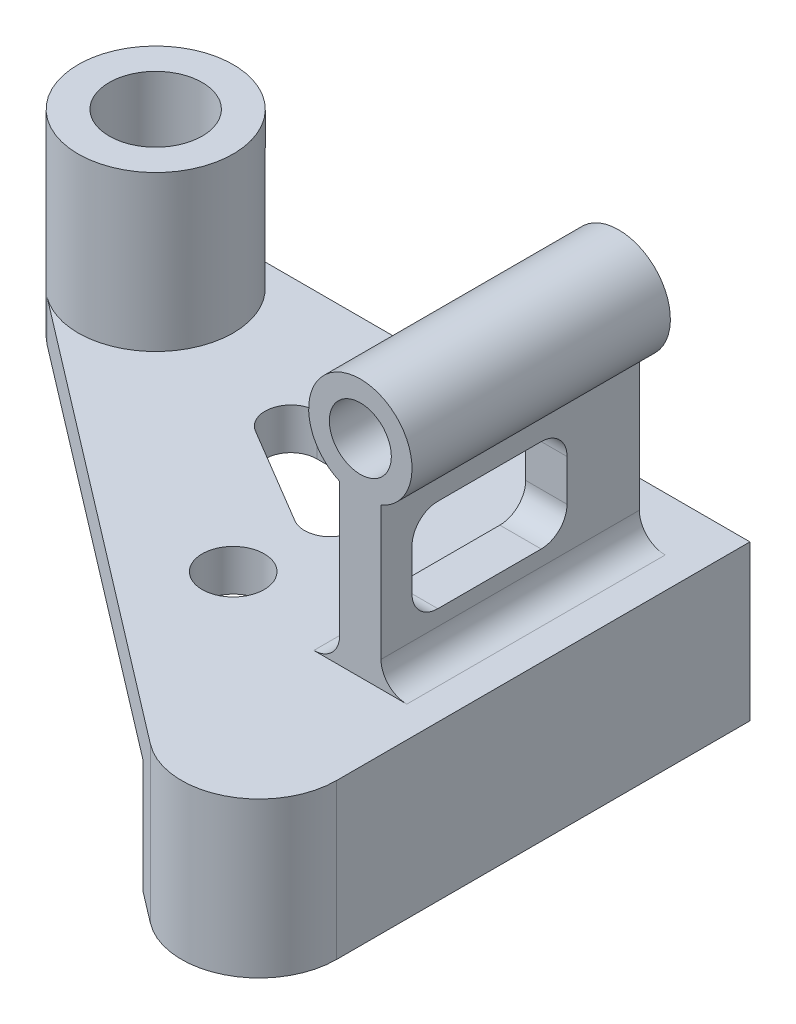
from build123d import *

# Parameters (mm, degrees)
SKETCH1_R           = 15
SKETCH1_R_2         = 9
SKETCH1_R_3         = 6
SKETCH1_W           = 10
SKETCH1_H           = 50
BOSS_EXTRUDE2_DEPTH = 30
SKETCH2_W           = 112.950636881
SKETCH2_H           = 38.744396061
CUT_EXTRUDE1_DEPTH  = 153.151240547
BOSS_EXTRUDE3_START = 30
SKETCH1_3_R         = 15
SKETCH1_3_R_2       = 9
BOSS_EXTRUDE3_DEPTH = 30
SKETCH1_4_W         = 20
SKETCH1_4_H         = 50
BOSS_EXTRUDE4_DEPTH = 50
SKETCH3_R           = 6
CUT_EXTRUDE2_DEPTH  = 140.185416071
FILLET1_R           = 5
CUT_EXTRUDE3_DEPTH  = 8


with BuildPart() as part:
    # Sketch1 → Boss-Extrude2 (new body)
    # profile 1 of 4: a face of its own
    with BuildSketch(Plane(origin=(0, 0, 0), x_dir=(1, 0, 0), z_dir=(0, 1, 0))):
        with Locations((-100, -15)):
            Circle(SKETCH1_R)
        with Locations(Location((-100, -15, 0), (0, 0, 270))):
            Circle(SKETCH1_R_2, mode=Mode.SUBTRACT)
    # profile 2 of 4: a face of its own
    with BuildSketch(Plane(origin=(0, 0, 0), x_dir=(1, 0, 0), z_dir=(0, 1, 0))):
        with BuildLine():
            Line((0, -80), (0, 0))
            Line((0, 0), (-100, 0))
            ThreePointArc((-100, 0), (-89.393398282, -4.393398282), (-85, -15))
            ThreePointArc((-85, -15), (-93.354560745, -28.447607114), (-109.111751614, -26.915367495))
            Line((-109.111751614, -26.915367495), (-24.111751614, -91.915367495))
            ThreePointArc((-24.111751614, -91.915367495), (-8.354560745, -93.447607114), (0, -80))
        make_face()
        with Locations(Location((-45, -55, 0), (0, 0, 270))):
            Circle(SKETCH1_R_3, mode=Mode.SUBTRACT)
        with BuildLine():
            ThreePointArc((-66.381939771, -29.296464422), (-68.64542921, -23.673787745), (-63.824520472, -20))
            Line((-63.824520472, -20), (-45, -20))
            ThreePointArc((-45, -20), (-41.464466094, -21.464466094), (-40, -25))
            Line((-40, -25), (-40, -36.20507171))
            ThreePointArc((-40, -36.20507171), (-42.528876419, -40.551742648), (-47.557419299, -40.501536132))
            Line((-47.557419299, -40.501536132), (-66.381939771, -29.296464422))
        make_face(mode=Mode.SUBTRACT)
        Polygon((-25, -60.395198873), (-25, -10.395198873), (-15, -10.395198873), (-5, -10.395198873), (-5, -60.395198873), (-15, -60.395198873), align=None, mode=Mode.SUBTRACT)
        with Locations(Location((-45, -10, 0), (0, 0, 270))):
            Circle(SKETCH1_R_3, mode=Mode.SUBTRACT)
    # profile 3 of 4: a face of its own
    with BuildSketch(Plane(origin=(0, 0, 0), x_dir=(1, 0, 0), z_dir=(0, 1, 0))):
        with Locations((-10, -35.395198873)):
            Rectangle(SKETCH1_W, SKETCH1_H)
    # profile 4 of 4: a face of its own
    with BuildSketch(Plane(origin=(0, 0, 0), x_dir=(1, 0, 0), z_dir=(0, 1, 0))):
        with Locations((-20, -35.395198873)):
            Rectangle(SKETCH1_W, SKETCH1_H)
    extrude(amount=-BOSS_EXTRUDE2_DEPTH)

    # Sketch2 → Cut-Extrude1 (cut, through all)
    with BuildSketch(Plane(origin=(0, 0, 0), x_dir=(-1, 0, 0), z_dir=(0, 0, -1))):
        with Locations((86.475318441, -27.372198031)):
            Rectangle(SKETCH2_W, SKETCH2_H)
    extrude(amount=-CUT_EXTRUDE1_DEPTH, mode=Mode.SUBTRACT)

    # Sketch1<3> → Boss-Extrude3 (add)
    with BuildSketch(Plane(origin=(0, 0, 0), x_dir=(1, 0, 0), z_dir=(0, 1, 0)).offset(BOSS_EXTRUDE3_START)):
        with Locations(Location((-100, -15, 0), (0, 0, 270))):
            Circle(SKETCH1_3_R)
        with Locations(Location((-100, -15, 0), (0, 0, 270))):
            Circle(SKETCH1_3_R_2, mode=Mode.SUBTRACT)
    extrude(amount=-BOSS_EXTRUDE3_DEPTH)

    # Sketch1<4> → Boss-Extrude4 (add)
    with BuildSketch(Plane(origin=(0, 0, 0), x_dir=(1, 0, 0), z_dir=(0, 1, 0))):
        with Locations((-15, -35.395198873)):
            Rectangle(SKETCH1_4_W, SKETCH1_4_H)
    extrude(amount=BOSS_EXTRUDE4_DEPTH)

    # Sketch3 → Cut-Extrude2 (cut, through all)
    with BuildSketch(Plane.XY.offset(60.395198873)):
        with BuildLine():
            ThreePointArc((-19, 30.83484861), (-23.366600265, 34.522774425), (-25, 40))
            Line((-25, 40), (-25, 0))
            Line((-25, 0), (-19, 0))
            Line((-19, 0), (-19, 30.83484861))
        make_face()
        with BuildLine():
            Line((-5, 0), (-5, 40))
            ThreePointArc((-5, 40), (-6.633399735, 34.522774425), (-11, 30.83484861))
            Line((-11, 30.83484861), (-11, 0))
            Line((-11, 0), (-5, 0))
        make_face()
        with BuildLine():
            Line((-5, 50), (-14.999999965, 50))
            ThreePointArc((-14.999999965, 50), (-7.928932176, 47.0710678), (-5, 40))
            Line((-5, 40), (-5, 50))
        make_face()
        with BuildLine():
            Line((-14.999999965, 50), (-25, 50))
            Line((-25, 50), (-25, 40))
            ThreePointArc((-25, 40), (-22.0710678, 47.071067824), (-14.999999965, 50))
        make_face()
        with Locations((-15, 40)):
            Circle(SKETCH3_R)
    extrude(amount=-CUT_EXTRUDE2_DEPTH, mode=Mode.SUBTRACT)

    # Fillet1
    fillet1_edges = [part.edges().sort_by_distance(p)[0] for p in [
        (-19, 0, 35.395198873),
        (-11, 0, 35.395198873),
    ]]
    fillet(fillet1_edges, radius=FILLET1_R)

    # Sketch4 → Cut-Extrude3 (cut)
    with BuildSketch(Plane(origin=(-11, 0, 0), x_dir=(0, 0, -1), z_dir=(1, 0, 0))):
        with BuildLine():
            Line((-49.395198873, 26), (-29.395198873, 26))
            ThreePointArc((-29.395198873, 26), (-25.859664967, 24.535533906), (-24.395198873, 21))
            Line((-24.395198873, 21), (-24.395198873, 13))
            ThreePointArc((-24.395198873, 13), (-25.859664967, 9.464466094), (-29.395198873, 8))
            Line((-29.395198873, 8), (-49.395198873, 8))
            ThreePointArc((-49.395198873, 8), (-52.930732779, 9.464466094), (-54.395198873, 13))
            Line((-54.395198873, 13), (-54.395198873, 21))
            ThreePointArc((-54.395198873, 21), (-52.930732779, 24.535533906), (-49.395198873, 26))
        make_face()
    extrude(amount=-CUT_EXTRUDE3_DEPTH, mode=Mode.SUBTRACT)


solid = part.part
